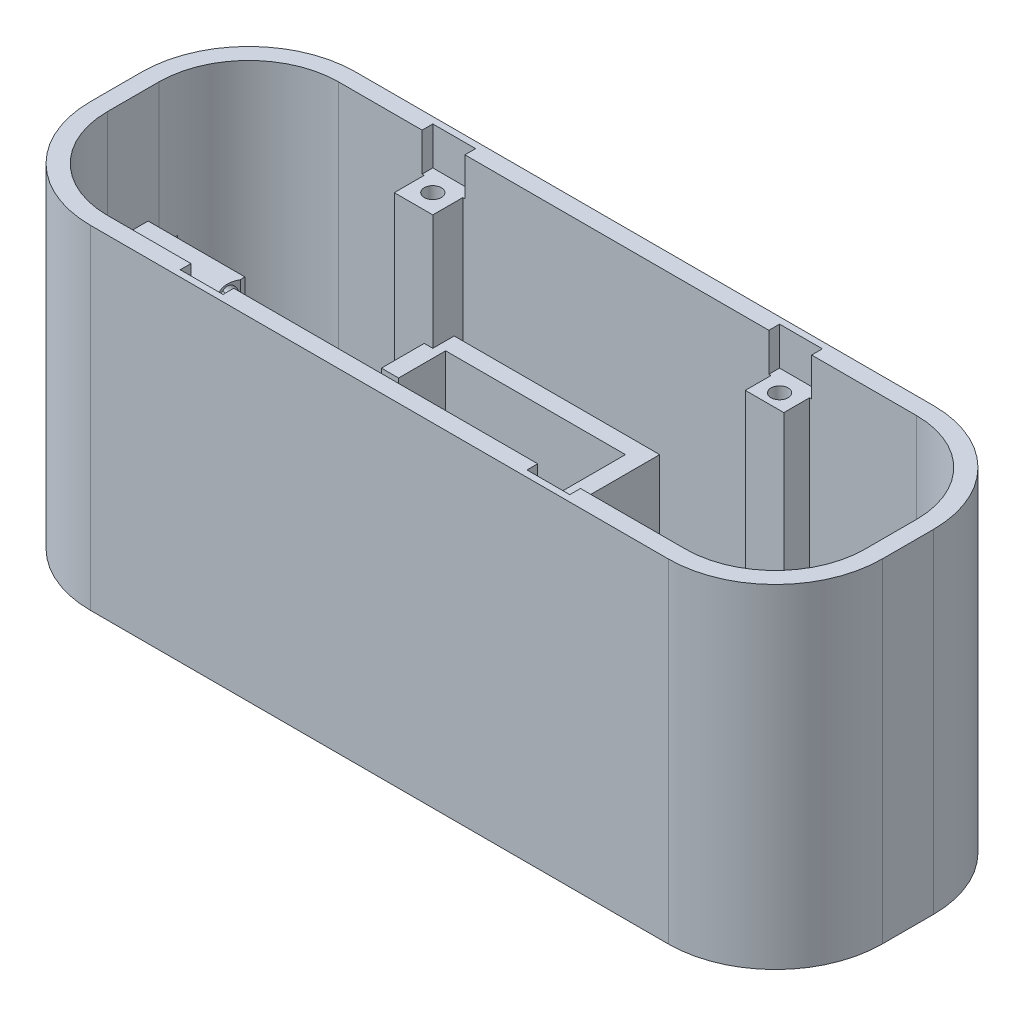
from build123d import *

# Parameters (mm, degrees)
SKETCH1_W                = 185
SKETCH1_H                = 62
BOSS_EXTRUDE1_DEPTH      = 80
FILLET1_R                = 25
CUT_EXTRUDE6_DEPTH       = 74
SKETCH19_R               = 22.5
SKETCH19_R_2             = 5
BOSS_EXTRUDE7_DEPTH      = 7
SKETCH25_W               = 20
SKETCH25_H               = 8
CUT_EXTRUDE16_DEPTH      = 14
CUT_EXTRUDE21_DEPTH      = 0.1
BOSS_EXTRUDE10_DEPTH     = 1
BOSS_EXTRUDE12_DEPTH     = 42
SKETCH30_W               = 9
SKETCH30_H               = 9
SKETCH30_R               = 2
SKETCH30_H_2             = 8
BOSS_EXTRUDE11_DEPTH     = 20
CUT_EXTRUDE27_START      = 80
SKETCH1_3_W              = 185
SKETCH1_3_H              = 62
CUT_EXTRUDE27_DEPTH      = 3
BOSS_EXTRUDE13_REACH     = 212.126
SKETCH30_3_W             = 9
SKETCH30_3_H             = 9
SKETCH30_3_R             = 2
SKETCH30_3_H_2           = 8
SKETCH30_6_W             = 9
SKETCH30_6_H             = 9
SKETCH30_6_R             = 2
SKETCH30_6_H_2           = 8
CUT_EXTRUDE29_DEPTH      = 9
SKETCH34_R               = 20.1
CUT_EXTRUDE30_DEPTH      = 3.5
SKETCH35_W               = 7
SKETCH35_H               = 5
SKETCH35_R               = 2.1
BOSS_EXTRUDE14_DEPTH     = 26.617816632
SKETCH35_2_R             = 2.1
CUT_EXTRUDE31_DEPTH      = 10
BOSS_EXTRUDE15_DEPTH     = 4
SKETCH37_R               = 5.1
SKETCH37_R_2             = 2.6
CUT_EXTRUDE32_DEPTH      = 5
SKETCH37_2_R             = 2.6
CUT_EXTRUDE33_DEPTH      = 45
SKETCH30_7_R             = 2
CUT_EXTRUDE34_DEPTH      = 74
CUT_EXTRUDE36_DEPTH      = 210.720313751
CUT_EXTRUDE36_DEPTH_BACK = 210.720313751
SKETCH19_3_R             = 5
SKETCH40_W               = 10
SKETCH40_H               = 10
CUT_EXTRUDE37_DEPTH      = 8.9
CUT_EXTRUDE38_DEPTH      = 4


with BuildPart() as part:
    # Sketch1 → Boss-Extrude1 (new body)
    with BuildSketch(Plane(origin=(0, 0, 0), x_dir=(1, 0, 0), z_dir=(0, 1, 0))):
        with Locations((92.5, 31)):
            Rectangle(SKETCH1_W, SKETCH1_H)
    extrude(amount=BOSS_EXTRUDE1_DEPTH)

    # Fillet1
    fillet1_edges = [part.edges().sort_by_distance(p)[0] for p in [
        (0, 40, -62),
        (185, 40, -62),
        (185, 40, 0),
        (0, 40, 0),
    ]]
    fillet(fillet1_edges, radius=FILLET1_R)

    # Sketch7 → Cut-Extrude6 (cut)
    with BuildSketch(Plane(origin=(0, 77, 0), x_dir=(1, 0, 0), z_dir=(0, 1, 0))):
        with BuildLine():
            Line((25, 58), (160, 58))
            ThreePointArc((160, 58), (174.849242405, 51.849242405), (181, 37))
            Line((181, 37), (181, 25))
            ThreePointArc((181, 25), (174.849242405, 10.150757595), (160, 4))
            Line((160, 4), (25, 4))
            ThreePointArc((25, 4), (10.150757595, 10.150757595), (4, 25))
            Line((4, 25), (4, 37))
            ThreePointArc((4, 37), (10.150757595, 51.849242405), (25, 58))
        make_face()
    extrude(amount=-CUT_EXTRUDE6_DEPTH, mode=Mode.SUBTRACT)

    # Sketch19 → Boss-Extrude7 (add)
    with BuildSketch(Plane.XZ):
        with Locations(Location((31, -31, 0), (0, 0, 270))):
            Circle(SKETCH19_R)
        with Locations(Location((31, -31, 0), (0, 0, 270))):
            Circle(SKETCH19_R_2, mode=Mode.SUBTRACT)
    extrude(amount=-BOSS_EXTRUDE7_DEPTH)

    # Sketch25 → Cut-Extrude16 (cut)
    with BuildSketch(Plane.ZY):
        with Locations((-31, 40)):
            Rectangle(SKETCH25_W, SKETCH25_H)
    extrude(amount=-CUT_EXTRUDE16_DEPTH, mode=Mode.SUBTRACT)

    # Sketch27 → Cut-Extrude21 (cut)
    with BuildSketch(Plane(origin=(0, 77, 0), x_dir=(1, 0, 0), z_dir=(0, 1, 0))):
        with BuildLine():
            Line((31, 73.5576089), (197.227071292, 73.5576089))
            ThreePointArc((197.227071292, 73.5576089), (239.784680192, 31), (197.227071292, -11.5576089))
            Line((197.227071292, -11.5576089), (31, -11.5576089))
            ThreePointArc((31, -11.5576089), (-11.5576089, 31), (31, 73.5576089))
        make_face()
        with BuildLine():
            Line((4.02, 37), (4.02, 25))
            ThreePointArc((4.02, 25), (10.164899731, 10.164899731), (25, 4.02))
            Line((25, 4.02), (160, 4.02))
            ThreePointArc((160, 4.02), (174.835100269, 10.164899731), (180.98, 25))
            Line((180.98, 25), (180.98, 37))
            ThreePointArc((180.98, 37), (174.835100269, 51.835100269), (160, 57.98))
            Line((160, 57.98), (25, 57.98))
            ThreePointArc((25, 57.98), (10.164899731, 51.835100269), (4.02, 37))
        make_face(mode=Mode.SUBTRACT)
    extrude(amount=-CUT_EXTRUDE21_DEPTH, mode=Mode.SUBTRACT)


with BuildPart() as cut_extrude21_piece_1:
    # of the separate pieces the step leaves, piece 1, a body of its own (cut_extrude21_pieces)
    add(part.part.solids().sort_by_distance((25, 0, 0))[0])

    # Sketch28 → Boss-Extrude10 (add)
    with BuildSketch(Plane.XZ):
        with BuildLine():
            Line((25, 0), (160, 0))
            ThreePointArc((160, 0), (177.67766953, -7.32233047), (185, -25))
            Line((185, -25), (185, -37))
            ThreePointArc((185, -37), (177.67766953, -54.67766953), (160, -62))
            Line((160, -62), (25, -62))
            ThreePointArc((25, -62), (7.32233047, -54.67766953), (0, -37))
            Line((0, -37), (0, -25))
            ThreePointArc((0, -25), (7.32233047, -7.32233047), (25, 0))
        make_face()
    extrude(amount=BOSS_EXTRUDE10_DEPTH)

    # Sketch32 → Boss-Extrude12 (add)
    with BuildSketch(Plane.XZ.offset(1)):
        Polygon((56, -10), (98, -10), (98, -52), (56, -52), (56, -41), (52, -41), (52, -56), (102, -56), (102, -6), (52, -6), (52, -21), (56, -21), align=None)
    extrude(amount=-BOSS_EXTRUDE12_DEPTH)

    # Sketch30 → Boss-Extrude11 (add)
    # profile 1 of 4: a face of its own
    with BuildSketch(Plane(origin=(0, 77, 0), x_dir=(1, 0, 0), z_dir=(0, 1, 0))):
        with Locations((49.5, 6.5)):
            Rectangle(SKETCH30_W, SKETCH30_H)
        with Locations(Location((49.5, 6.5, 0), (0, 0, 270))):
            Circle(SKETCH30_R, mode=Mode.SUBTRACT)
    # profile 2 of 4: a face of its own
    with BuildSketch(Plane(origin=(0, 77, 0), x_dir=(1, 0, 0), z_dir=(0, 1, 0))):
        with Locations((49.5, 55.5)):
            Rectangle(SKETCH30_W, SKETCH30_H)
        with Locations(Location((49.5, 55.5, 0), (0, 0, 270))):
            Circle(SKETCH30_R, mode=Mode.SUBTRACT)
    # profile 3 of 4: a face of its own
    with BuildSketch(Plane(origin=(0, 77, 0), x_dir=(1, 0, 0), z_dir=(0, 1, 0))):
        with Locations((130.5, 56)):
            Rectangle(SKETCH30_W, SKETCH30_H_2)
        with Locations(Location((130.5, 55.5, 0), (0, 0, 270))):
            Circle(SKETCH30_R, mode=Mode.SUBTRACT)
    # profile 4 of 4: a face of its own
    with BuildSketch(Plane(origin=(0, 77, 0), x_dir=(1, 0, 0), z_dir=(0, 1, 0))):
        with Locations((130.5, 6)):
            Rectangle(SKETCH30_W, SKETCH30_H_2)
        with Locations(Location((130.5, 6.5, 0), (0, 0, 270))):
            Circle(SKETCH30_R, mode=Mode.SUBTRACT)
    extrude(amount=-BOSS_EXTRUDE11_DEPTH)

    # Sketch30<3> → Boss-Extrude13 (add, up to next)
    with BuildSketch(Plane(origin=(0, 77, 0), x_dir=(1, 0, 0), z_dir=(0, 1, 0)), mode=Mode.PRIVATE) as boss_extrude13_sk1:
        with Locations((49.5, 6.5)):
            Rectangle(SKETCH30_3_W, SKETCH30_3_H)
        with Locations(Location((49.5, 6.5, 0), (0, 0, 270))):
            Circle(SKETCH30_3_R, mode=Mode.SUBTRACT)
    boss_extrude13_tool1 = extrude(boss_extrude13_sk1.sketch, amount=-BOSS_EXTRUDE13_REACH, mode=Mode.PRIVATE) - cut_extrude21_piece_1.part
    # Sketch30<3> → Boss-Extrude13 (add, up to next)
    with BuildSketch(Plane(origin=(0, 77, 0), x_dir=(1, 0, 0), z_dir=(0, 1, 0)), mode=Mode.PRIVATE) as boss_extrude13_sk2:
        with Locations((49.5, 55.5)):
            Rectangle(SKETCH30_3_W, SKETCH30_3_H)
        with Locations(Location((49.5, 55.5, 0), (0, 0, 270))):
            Circle(SKETCH30_3_R, mode=Mode.SUBTRACT)
    boss_extrude13_tool2 = extrude(boss_extrude13_sk2.sketch, amount=-BOSS_EXTRUDE13_REACH, mode=Mode.PRIVATE) - cut_extrude21_piece_1.part
    # Sketch30<3> → Boss-Extrude13 (add, up to next)
    with BuildSketch(Plane(origin=(0, 77, 0), x_dir=(1, 0, 0), z_dir=(0, 1, 0)), mode=Mode.PRIVATE) as boss_extrude13_sk3:
        with Locations((130.5, 56)):
            Rectangle(SKETCH30_3_W, SKETCH30_3_H_2)
        with Locations(Location((130.5, 55.5, 0), (0, 0, 270))):
            Circle(SKETCH30_3_R, mode=Mode.SUBTRACT)
    boss_extrude13_tool3 = extrude(boss_extrude13_sk3.sketch, amount=-BOSS_EXTRUDE13_REACH, mode=Mode.PRIVATE) - cut_extrude21_piece_1.part
    # Sketch30<3> → Boss-Extrude13 (add, up to next)
    with BuildSketch(Plane(origin=(0, 77, 0), x_dir=(1, 0, 0), z_dir=(0, 1, 0)), mode=Mode.PRIVATE) as boss_extrude13_sk4:
        with Locations((130.5, 6)):
            Rectangle(SKETCH30_3_W, SKETCH30_3_H_2)
        with Locations(Location((130.5, 6.5, 0), (0, 0, 270))):
            Circle(SKETCH30_3_R, mode=Mode.SUBTRACT)
    boss_extrude13_tool4 = extrude(boss_extrude13_sk4.sketch, amount=-BOSS_EXTRUDE13_REACH, mode=Mode.PRIVATE) - cut_extrude21_piece_1.part
    add(boss_extrude13_tool1.solids().sort_by_distance((49.5, 77, -10.872721))[0])
    add(boss_extrude13_tool2.solids().sort_by_distance((49.5, 77, -59.872721))[0])
    add(boss_extrude13_tool3.solids().sort_by_distance((130.5, 77, -59.879584))[0])
    add(boss_extrude13_tool4.solids().sort_by_distance((130.5, 77, -9.879584))[0])

    # Sketch30<6> → Cut-Extrude29 (cut)
    # profile 1 of 4: a face of its own
    with BuildSketch(Plane(origin=(0, 77, 0), x_dir=(1, 0, 0), z_dir=(0, 1, 0))):
        with Locations((49.5, 6.5)):
            Rectangle(SKETCH30_6_W, SKETCH30_6_H)
        with Locations(Location((49.5, 6.5, 0), (0, 0, 270))):
            Circle(SKETCH30_6_R, mode=Mode.SUBTRACT)
    # profile 2 of 4: a face of its own
    with BuildSketch(Plane(origin=(0, 77, 0), x_dir=(1, 0, 0), z_dir=(0, 1, 0))):
        with Locations((49.5, 55.5)):
            Rectangle(SKETCH30_6_W, SKETCH30_6_H)
        with Locations(Location((49.5, 55.5, 0), (0, 0, 270))):
            Circle(SKETCH30_6_R, mode=Mode.SUBTRACT)
    # profile 3 of 4: a face of its own
    with BuildSketch(Plane(origin=(0, 77, 0), x_dir=(1, 0, 0), z_dir=(0, 1, 0))):
        with Locations((130.5, 56)):
            Rectangle(SKETCH30_6_W, SKETCH30_6_H_2)
        with Locations(Location((130.5, 55.5, 0), (0, 0, 270))):
            Circle(SKETCH30_6_R, mode=Mode.SUBTRACT)
    # profile 4 of 4: a face of its own
    with BuildSketch(Plane(origin=(0, 77, 0), x_dir=(1, 0, 0), z_dir=(0, 1, 0))):
        with Locations((130.5, 6)):
            Rectangle(SKETCH30_6_W, SKETCH30_6_H_2)
        with Locations(Location((130.5, 6.5, 0), (0, 0, 270))):
            Circle(SKETCH30_6_R, mode=Mode.SUBTRACT)
    extrude(amount=-CUT_EXTRUDE29_DEPTH, mode=Mode.SUBTRACT)

    # Sketch34 → Cut-Extrude30 (cut)
    with BuildSketch(Plane.XZ.offset(1)):
        with Locations(Location((31, -31, 0), (0, 0, 270))):
            Circle(SKETCH34_R)
    extrude(amount=-CUT_EXTRUDE30_DEPTH, mode=Mode.SUBTRACT)

    # Sketch35 → Boss-Extrude14 (add)
    # profile 1 of 2: a face of its own
    with BuildSketch(Plane.ZY):
        with Locations((-31, 47.5)):
            Rectangle(SKETCH35_W, SKETCH35_H)
        with Locations((-31, 47.5)):
            Circle(SKETCH35_R, mode=Mode.SUBTRACT)
    # profile 2 of 2: a face of its own
    with BuildSketch(Plane.ZY):
        with Locations((-31, 32.5)):
            Rectangle(SKETCH35_W, SKETCH35_H)
        with Locations((-31, 32.5)):
            Circle(SKETCH35_R, mode=Mode.SUBTRACT)
    extrude(amount=-BOSS_EXTRUDE14_DEPTH)

    # Sketch35<2> → Cut-Extrude31 (cut)
    with BuildSketch(Plane.ZY):
        with Locations((-31, 47.5)):
            Circle(SKETCH35_2_R)
        with Locations((-31, 32.5)):
            Circle(SKETCH35_2_R)
    extrude(amount=-CUT_EXTRUDE31_DEPTH, mode=Mode.SUBTRACT)

    # Sketch36 → Boss-Extrude15 (add)
    with BuildSketch(Plane(origin=(0, 3, 0), x_dir=(1, 0, 0), z_dir=(0, 1, 0))):
        with BuildLine():
            Line((102, 58), (160, 58))
            ThreePointArc((160, 58), (174.849242405, 51.849242405), (181, 37))
            Line((181, 37), (181, 25))
            ThreePointArc((181, 25), (174.849242405, 10.150757595), (160, 4))
            Line((160, 4), (102, 4))
            Line((102, 4), (102, 58))
        make_face()
    extrude(amount=BOSS_EXTRUDE15_DEPTH)

    # Sketch37 → Cut-Extrude32 (cut)
    # profile 1 of 2: a face of its own
    with BuildSketch(Plane.XZ.offset(1)):
        with Locations(Location((135.75, -31, 0), (0, 0, 270))):
            Circle(SKETCH37_R)
        with Locations(Location((135.75, -31, 0), (0, 0, 270))):
            Circle(SKETCH37_R_2, mode=Mode.SUBTRACT)
    # profile 2 of 2: a face of its own
    with BuildSketch(Plane.XZ.offset(1)):
        with Locations(Location((172.25, -31, 0), (0, 0, 270))):
            Circle(SKETCH37_R)
        with Locations(Location((172.25, -31, 0), (0, 0, 270))):
            Circle(SKETCH37_R_2, mode=Mode.SUBTRACT)
    extrude(amount=-CUT_EXTRUDE32_DEPTH, mode=Mode.SUBTRACT)

    # Sketch37<2> → Cut-Extrude33 (cut)
    with BuildSketch(Plane.XZ.offset(1)):
        with Locations(Location((135.75, -31, 0), (0, 0, 270))):
            Circle(SKETCH37_2_R)
        with Locations(Location((172.25, -31, 0), (0, 0, 270))):
            Circle(SKETCH37_2_R)
    extrude(amount=-CUT_EXTRUDE33_DEPTH, mode=Mode.SUBTRACT)

    # Sketch30<7> → Cut-Extrude34 (cut)
    with BuildSketch(Plane(origin=(0, 77, 0), x_dir=(1, 0, 0), z_dir=(0, 1, 0))):
        with Locations(Location((130.5, 55.5, 0), (0, 0, 270))):
            Circle(SKETCH30_7_R)
        with Locations(Location((130.5, 6.5, 0), (0, 0, 270))):
            Circle(SKETCH30_7_R)
    extrude(amount=-CUT_EXTRUDE34_DEPTH, mode=Mode.SUBTRACT)

    # Sketch19<3> → Cut-Extrude36 (cut, two sides: drawn at the far end of the back side and taken through both)
    with BuildSketch(Plane.XZ.offset(-CUT_EXTRUDE36_DEPTH_BACK)):
        with Locations(Location((31, -31, 0), (0, 0, 270))):
            Circle(SKETCH19_3_R)
    extrude(amount=CUT_EXTRUDE36_DEPTH + CUT_EXTRUDE36_DEPTH_BACK, mode=Mode.SUBTRACT)

    # Sketch40 → Cut-Extrude37 (cut)
    with BuildSketch(Plane(origin=(0, 76.9, 0), x_dir=(1, 0, 0), z_dir=(0, 1, 0))):
        with Locations((49.5, 55.5)):
            Rectangle(SKETCH40_W, SKETCH40_H)
        with Locations((130.5, 55.5)):
            Rectangle(SKETCH40_W, SKETCH40_H)
        with Locations((130.5, 6.5)):
            Rectangle(SKETCH40_W, SKETCH40_H)
        with Locations((49.5, 6.5)):
            Rectangle(SKETCH40_W, SKETCH40_H)
    extrude(amount=-CUT_EXTRUDE37_DEPTH, mode=Mode.SUBTRACT)

    # Sketch41 → Cut-Extrude38 (cut)
    with BuildSketch(Plane(origin=(0, 7, 0), x_dir=(1, 0, 0), z_dir=(0, 1, 0))):
        Polygon((59.137774549, 41), (52, 41), (52, 48.298784504), (44.023897819, 51), (40, 55.549872581), (40, 8.169228787), (52, 15.585441997), (52, 21), (56, 21), align=None)
    extrude(amount=-CUT_EXTRUDE38_DEPTH, mode=Mode.SUBTRACT)


with BuildPart() as cut_extrude21_piece_2:
    # of the separate pieces the step leaves, piece 2, a body of its own (cut_extrude21_pieces)
    add(part.part.solids().sort_by_distance((160, 77, 0))[0])

    # Sketch1<3> → Cut-Extrude27 (cut)
    with BuildSketch(Plane(origin=(0, 0, 0), x_dir=(1, 0, 0), z_dir=(0, 1, 0)).offset(CUT_EXTRUDE27_START)):
        with Locations((92.5, 31)):
            Rectangle(SKETCH1_3_W, SKETCH1_3_H)
    extrude(amount=-CUT_EXTRUDE27_DEPTH, mode=Mode.SUBTRACT)


solid = cut_extrude21_piece_1.part
